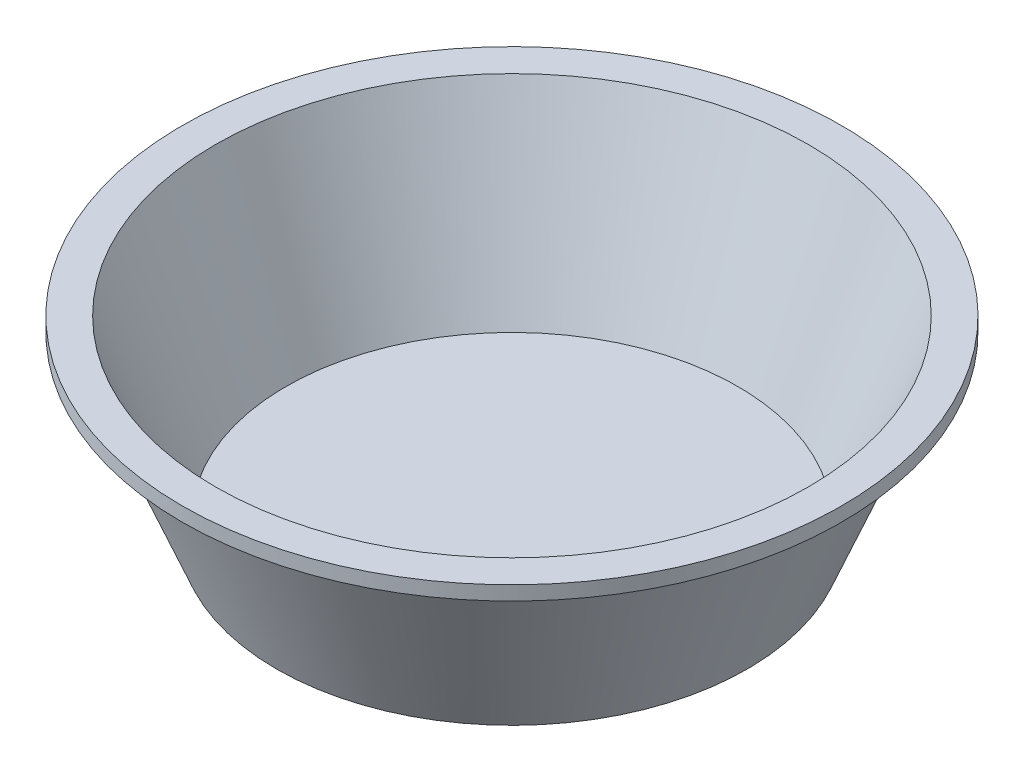
from build123d import *


with BuildPart() as part:
    # Sketch1 → Revolve1 (revolve)
    with BuildSketch(Plane.XY, mode=Mode.PRIVATE) as revolve1_sk:
        Polygon((0, 0), (50, 0), (65, 37), (70, 37), (70, 40), (62.979059766, 40), (47.979059766, 3), (0, 3), align=None)
    revolve(revolve1_sk.sketch.rotate(Axis((0, 3, 0), (0, -1, 0)), 90), axis=Axis((0, 3, 0), (0, -1, 0)))


solid = part.part
